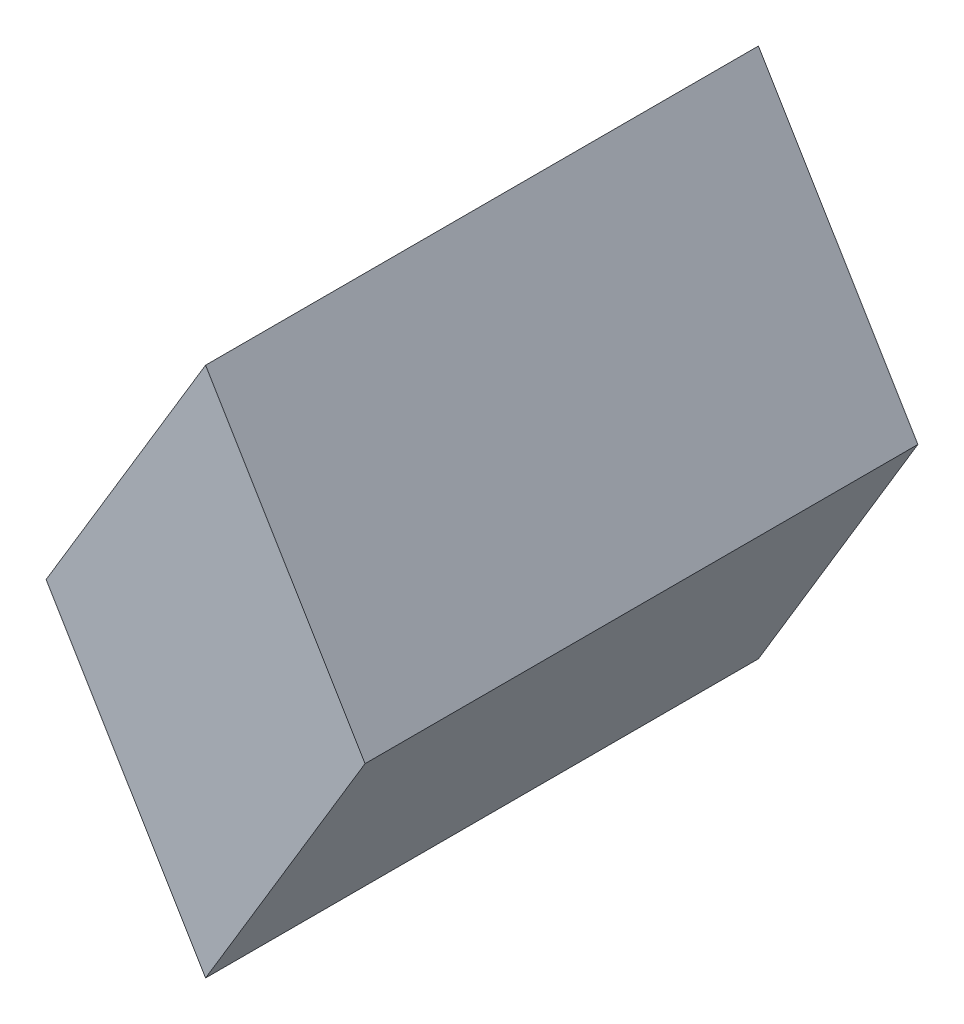
from build123d import *

# Parameters (mm, degrees)
SALIENTE_EXTRUIR1_DEPTH = 50
CROQUIS2_R              = 5
CORTAR_EXTRUIR1_DEPTH   = 10


with BuildPart() as part:
    # Croquis1 → Saliente-Extruir1 (new body)
    with BuildSketch(Plane.XY):
        Polygon((0, 24.535031847), (14.422205102, 0.535031847), (0, -23.464968153), (-14.422205102, 0.535031847), align=None)
    extrude(amount=SALIENTE_EXTRUIR1_DEPTH)

    # Croquis2 → Cortar-Extruir1 (cut)
    with BuildSketch(Plane(origin=(0, 0, 0), x_dir=(-1, 0, 0), z_dir=(0, 0, -1))):
        Circle(CROQUIS2_R)
    extrude(amount=-CORTAR_EXTRUIR1_DEPTH, mode=Mode.SUBTRACT)


solid = part.part
